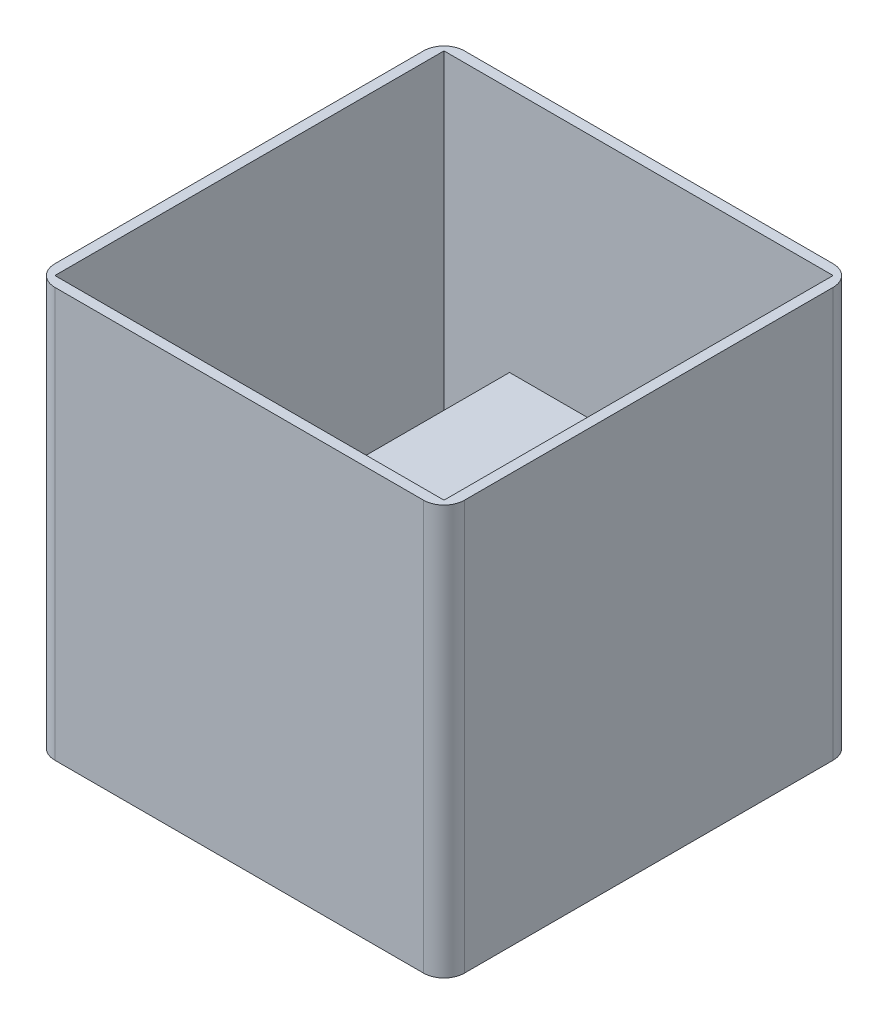
from build123d import *

# Parameters (mm, degrees)
SKETCH1_W             = 200
SKETCH1_H             = 200
BOSS_EXTRUDE1_DEPTH   = 200
SKETCH2_W             = 190
SKETCH2_H             = 190
CUT_EXTRUDE1_DEPTH    = 120
CUT_EXTRUDE2_DEPTH    = 75
CUT_EXTRUDE3_DEPTH    = 320
CUT_EXTRUDE4_DEPTH    = 50
CUT_EXTRUDE5_DEPTH    = 10
CROQUIS1_R            = 2.5
CORTAR_EXTRUIR1_DEPTH = 15
REDONDEO1_R           = 10


with BuildPart() as part:
    # Sketch1 → Boss-Extrude1 (new body)
    with BuildSketch(Plane(origin=(0, 0, 0), x_dir=(1, 0, 0), z_dir=(0, 1, 0))):
        Rectangle(SKETCH1_W, SKETCH1_H)
    extrude(amount=-BOSS_EXTRUDE1_DEPTH)

    # Sketch2 → Cut-Extrude1 (cut)
    with BuildSketch(Plane(origin=(0, 0, 0), x_dir=(1, 0, 0), z_dir=(0, 1, 0))):
        Rectangle(SKETCH2_W, SKETCH2_H)
    extrude(amount=-CUT_EXTRUDE1_DEPTH, mode=Mode.SUBTRACT)

    # Sketch3 → Cut-Extrude2 (cut)
    with BuildSketch(Plane(origin=(0, -200, 0), x_dir=(-1, 0, 0), z_dir=(0, -1, 0))):
        with BuildLine():
            Line((-60, 18.105219257), (-60, 87))
            ThreePointArc((-60, 87), (-57.071067812, 94.071067812), (-50, 97))
            Line((-50, 97), (50, 97))
            ThreePointArc((50, 97), (57.071067812, 94.071067812), (60, 87))
            Line((60, 87), (60, 18.105219257))
            Line((60, 18.105219257), (60, -13))
            ThreePointArc((60, -13), (57.071067812, -20.071067812), (50, -23))
            Line((50, -23), (-50, -23))
            ThreePointArc((-50, -23), (-57.071067812, -20.071067812), (-60, -13))
            Line((-60, -13), (-60, 18.105219257))
        make_face()
    extrude(amount=-CUT_EXTRUDE2_DEPTH, mode=Mode.SUBTRACT)

    # Sketch4 → Cut-Extrude3 (cut)
    with BuildSketch(Plane(origin=(0, -125, 0), x_dir=(-1, 0, 0), z_dir=(0, -1, 0))):
        with BuildLine():
            Line((11, -3.5), (-11, -3.5))
            ThreePointArc((-11, -3.5), (-11.5, -3), (-11, -2.5))
            Line((-11, -2.5), (11, -2.5))
            ThreePointArc((11, -2.5), (11.5, -3), (11, -3.5))
        make_face()
    extrude(amount=-CUT_EXTRUDE3_DEPTH, mode=Mode.SUBTRACT)

    # Sketch5 → Cut-Extrude4 (cut)
    with BuildSketch(Plane(origin=(0, -120, 0), x_dir=(1, 0, 0), z_dir=(0, 1, 0))):
        Polygon((-63, 95), (-63, -26), (63, -26), (63, 95), (95, 95), (95, -95), (-95, -95), (-95, 95), align=None)
    extrude(amount=-CUT_EXTRUDE4_DEPTH, mode=Mode.SUBTRACT)

    # Sketch6 → Cut-Extrude5 (cut)
    with BuildSketch(Plane.XZ.offset(200)):
        with BuildLine():
            Line((-70, -44), (-75, -44))
            ThreePointArc((-75, -44), (-82, -37), (-75, -30))
            Line((-75, -30), (-70, -30))
            ThreePointArc((-70, -30), (-62.928932188, -27.071067812), (-60, -20))
            Line((-60, -20), (-60, -54))
            ThreePointArc((-60, -54), (-62.928932188, -46.928932188), (-70, -44))
        make_face()
        with BuildLine():
            Line((70, -44), (75, -44))
            ThreePointArc((75, -44), (82, -37), (75, -30))
            Line((75, -30), (70, -30))
            ThreePointArc((70, -30), (62.928932188, -27.071067812), (60, -20))
            Line((60, -20), (60, -54))
            ThreePointArc((60, -54), (62.928932188, -46.928932188), (70, -44))
        make_face()
    extrude(amount=-CUT_EXTRUDE5_DEPTH, mode=Mode.SUBTRACT)

    # Croquis1 → Cortar-Extruir1 (cut)
    with BuildSketch(Plane.XZ.offset(190)):
        with Locations(Location((-75, -37, 0), (0, 0, 270))):
            Circle(CROQUIS1_R)
        with Locations(Location((75, -37, 0), (0, 0, 90))):
            Circle(CROQUIS1_R)
    extrude(amount=-CORTAR_EXTRUIR1_DEPTH, mode=Mode.SUBTRACT)

    # Redondeo1
    redondeo1_edges = [part.edges().sort_by_distance(p)[0] for p in [
        (100, -100, 100),
        (-100, -100, 100),
        (-100, -100, -100),
        (100, -100, -100),
    ]]
    fillet(redondeo1_edges, radius=REDONDEO1_R)


solid = part.part
